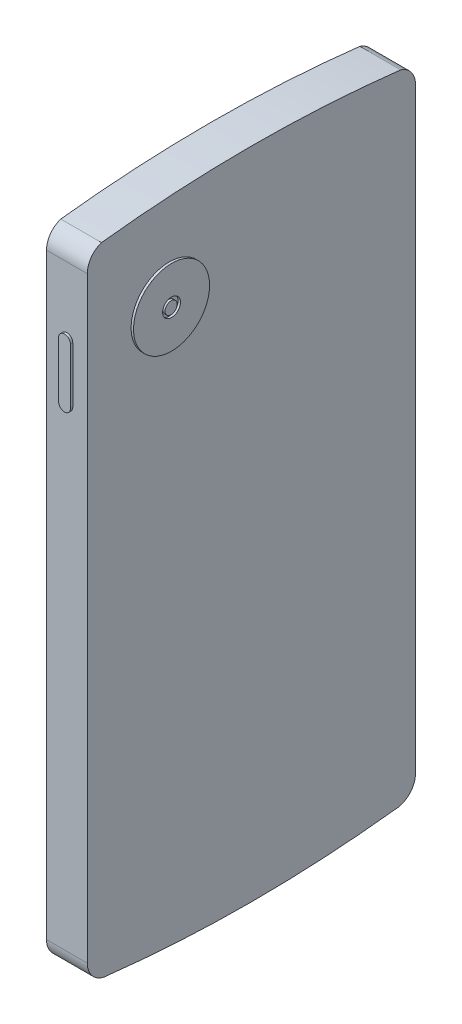
from build123d import *

# Parameters (mm, degrees)
BOSS_EXTRU_2_DEPTH      = 8.59
ESQUISSE2_W             = 65.898874386
ESQUISSE2_H             = 107.963346122
ENL_V_MAT_EXTRU_1_DEPTH = 0.005
ESQUISSE3_R             = 2.412142612
ENL_V_MAT_EXTRU_2_DEPTH = 0.005
ESQUISSE4_R             = 0.192943447
ENL_V_MAT_EXTRU_3_DEPTH = 0.005
ESQUISSE5_R             = 1.43866859
ENL_V_MAT_EXTRU_4_DEPTH = 0.05
ENL_V_MAT_EXTRU_4_DRAFT = -83
ESQUISSE6_R             = 8.014182706
ESQUISSE6_R_2           = 1.878366617
BOSS_EXTRU_4_DEPTH      = 0.5
ESQUISSE9_R             = 1.272333161
BOSS_EXTRU_6_DEPTH      = 0.5
BOSS_EXTRU_7_DEPTH      = 0.5
BOSS_EXTRU_8_DEPTH      = 0.5


with BuildPart() as part:
    # Esquisse1 → Boss.-Extru.2 (new body)
    with BuildSketch(Plane(origin=(0, 0, 0), x_dir=(0, 0, -1), z_dir=(1, 0, 0))):
        with BuildLine():
            ThreePointArc((-64.77410887, 1.608875783), (-67.882473298, 2.896402486), (-69.17, 6.004766913))
            Line((-69.17, 6.004766913), (-69.17, 131.84))
            ThreePointArc((-69.17, 131.84), (-68.342656845, 134.406967896), (-66.17205306, 136.007686512))
            ThreePointArc((-66.17205306, 136.007686512), (-34.652702248, 137.84), (-3.133351436, 136.007686512))
            ThreePointArc((-3.133351436, 136.007686512), (-0.86928895, 134.42130061), (0, 131.797003391))
            Line((0, 131.797003391), (0, 6.004766913))
            ThreePointArc((0, 6.004766913), (-1.287526702, 2.896402486), (-4.39589113, 1.608875783))
            ThreePointArc((-4.39589113, 1.608875783), (-34.585, -0.123346122), (-64.77410887, 1.608875783))
        make_face()
    extrude(amount=BOSS_EXTRU_2_DEPTH)

    # Esquisse2 → Enlèv. mat.-Extru.1 (cut)
    with BuildSketch(Plane.ZY):
        with Locations((34.618851124, 68.858326939)):
            Rectangle(ESQUISSE2_W, ESQUISSE2_H)
    extrude(amount=-ENL_V_MAT_EXTRU_1_DEPTH, mode=Mode.SUBTRACT)

    # Esquisse3 → Enlèv. mat.-Extru.2 (cut)
    with BuildSketch(Plane.ZY):
        with Locations((34.63304788, 129.130820167)):
            Circle(ESQUISSE3_R)
    extrude(amount=-ENL_V_MAT_EXTRU_2_DEPTH, mode=Mode.SUBTRACT)

    # Esquisse4 → Enlèv. mat.-Extru.3 (cut)
    with BuildSketch(Plane.ZY.offset(-0.005)):
        with Locations((36.726320497, 129.130820167)):
            Circle(ESQUISSE4_R)
        with Locations((36.567061466, 128.328530612)):
            Circle(ESQUISSE4_R)
        with Locations((36.112902385, 127.648257506)):
            Circle(ESQUISSE4_R)
        with Locations((35.432984859, 127.193566263)):
            Circle(ESQUISSE4_R)
        with Locations((34.630820167, 127.033679503)):
            Circle(ESQUISSE4_R)
        with Locations((33.828530612, 127.192938534)):
            Circle(ESQUISSE4_R)
        with Locations((33.148257506, 127.647097615)):
            Circle(ESQUISSE4_R)
        with Locations((32.693566263, 128.327015141)):
            Circle(ESQUISSE4_R)
        with Locations((32.533679503, 129.129179833)):
            Circle(ESQUISSE4_R)
        with Locations((32.692938534, 129.931469388)):
            Circle(ESQUISSE4_R)
        with Locations((33.147097615, 130.611742494)):
            Circle(ESQUISSE4_R)
        with Locations((33.827015141, 131.066433737)):
            Circle(ESQUISSE4_R)
        with Locations((34.629179833, 131.226320497)):
            Circle(ESQUISSE4_R)
        with Locations((35.431469388, 131.067061466)):
            Circle(ESQUISSE4_R)
        with Locations((36.111742494, 130.612902385)):
            Circle(ESQUISSE4_R)
        with Locations((36.566433737, 129.932984859)):
            Circle(ESQUISSE4_R)
        with Locations((36.111742494, 129.130820167)):
            Circle(ESQUISSE4_R)
        with Locations((35.431469388, 129.130820167)):
            Circle(ESQUISSE4_R)
        with Locations((34.63304788, 129.130820167)):
            Circle(ESQUISSE4_R)
        with Locations((35.910780599, 128.380820167)):
            Circle(ESQUISSE4_R)
        with Locations((35.361742494, 127.831782061)):
            Circle(ESQUISSE4_R)
        with Locations((34.611742494, 127.630820167)):
            Circle(ESQUISSE4_R)
        with Locations((33.861742494, 127.831782061)):
            Circle(ESQUISSE4_R)
        with Locations((33.312704388, 128.380820167)):
            Circle(ESQUISSE4_R)
        with Locations((33.111742494, 129.130820167)):
            Circle(ESQUISSE4_R)
        with Locations((33.312704388, 129.880820167)):
            Circle(ESQUISSE4_R)
        with Locations((33.861742494, 130.429858273)):
            Circle(ESQUISSE4_R)
        with Locations((34.611742494, 130.630820167)):
            Circle(ESQUISSE4_R)
        with Locations((35.361742494, 130.429858273)):
            Circle(ESQUISSE4_R)
        with Locations((35.910780599, 129.880820167)):
            Circle(ESQUISSE4_R)
        with Locations((35.167865491, 128.494424064)):
            Circle(ESQUISSE4_R)
        with Locations((34.531469388, 128.230820167)):
            Circle(ESQUISSE4_R)
        with Locations((33.895073285, 128.494424064)):
            Circle(ESQUISSE4_R)
        with Locations((33.631469388, 129.130820167)):
            Circle(ESQUISSE4_R)
        with Locations((33.895073285, 129.76721627)):
            Circle(ESQUISSE4_R)
        with Locations((34.531469388, 130.030820167)):
            Circle(ESQUISSE4_R)
        with Locations((35.167865491, 129.76721627)):
            Circle(ESQUISSE4_R)
    extrude(amount=-ENL_V_MAT_EXTRU_3_DEPTH, mode=Mode.SUBTRACT)


with BuildPart() as enl_v_mat_extru_4_tool:
    # Esquisse5 → Enlèv. mat.-Extru.4 (with draft: the straight prism first)
    with BuildSketch(Plane.ZY):
        with Locations((15.373502025, 128.968455562)):
            Circle(ESQUISSE5_R)
    extrude(amount=-ENL_V_MAT_EXTRU_4_DEPTH)
    # Enlèv. mat.-Extru.4: the draft: its side faces are tilted about the plane it starts from
    enl_v_mat_extru_4_sides = [enl_v_mat_extru_4_tool.faces().sort_by_distance(p)[0] for p in [
        (0.025, 128.968455562, 13.934833435),
    ]]
    draft(enl_v_mat_extru_4_sides, Plane.ZY, ENL_V_MAT_EXTRU_4_DRAFT)


with BuildPart() as part_1:
    add(part.part)

    # Enlèv. mat.-Extru.4: cut by enl_v_mat_extru_4_tool
    add(enl_v_mat_extru_4_tool.part, mode=Mode.SUBTRACT)

    # Esquisse10 → Boss.-Extru.7 (add)
    with BuildSketch(Plane(origin=(0, 0, 0), x_dir=(-1, 0, 0), z_dir=(0, 0, -1))):
        with BuildLine():
            Line((-3.27497576, 113.367082092), (-3.27497576, 94.781226641))
            ThreePointArc((-3.27497576, 94.781226641), (-4.295, 93.761202401), (-5.31502424, 94.781226641))
            Line((-5.31502424, 94.781226641), (-5.31502424, 113.367082092))
            ThreePointArc((-5.31502424, 113.367082092), (-4.295, 114.387106332), (-3.27497576, 113.367082092))
        make_face()
    extrude(amount=BOSS_EXTRU_7_DEPTH)

    # Esquisse11 → Boss.-Extru.8 (add)
    with BuildSketch(Plane.XY.offset(69.17)):
        with BuildLine():
            Line((5.535218505, 117.688519716), (5.535218505, 105.932818998))
            ThreePointArc((5.535218505, 105.932818998), (4.295, 104.692600493), (3.054781495, 105.932818998))
            Line((3.054781495, 105.932818998), (3.054781495, 117.688519716))
            ThreePointArc((3.054781495, 117.688519716), (4.295, 118.92873822), (5.535218505, 117.688519716))
        make_face()
    extrude(amount=BOSS_EXTRU_8_DEPTH)


with BuildPart() as body_2:
    # Esquisse6 → Boss.-Extru.4 (new body)
    with BuildSketch(Plane(origin=(8.59, 0, 0), x_dir=(0, 0, -1), z_dir=(1, 0, 0))):
        with Locations((-51.911351124, 117.324260336)):
            Circle(ESQUISSE6_R)
        with Locations((-51.911351124, 117.324260336)):
            Circle(ESQUISSE6_R_2, mode=Mode.SUBTRACT)
    extrude(amount=BOSS_EXTRU_4_DEPTH)


with BuildPart() as body_3:
    # Esquisse9 → Boss.-Extru.6 (new body)
    with BuildSketch(Plane(origin=(8.59, 0, 0), x_dir=(0, 0, -1), z_dir=(1, 0, 0))):
        with Locations((-52.012632367, 117.286255361)):
            Circle(ESQUISSE9_R)
    extrude(amount=BOSS_EXTRU_6_DEPTH)


solid = Compound([part_1.part, body_2.part, body_3.part])
